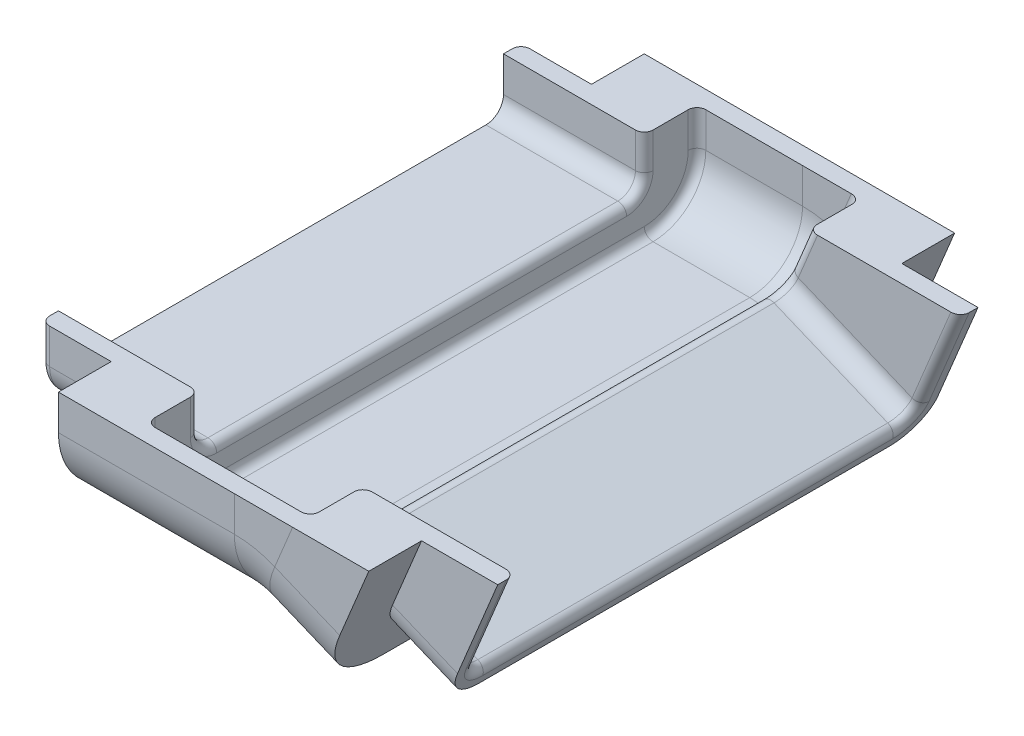
from build123d import *

# Parameters (mm, degrees)
BOSS_EXTRUDE6_DEPTH = 4
BOSS_EXTRUDE7_DEPTH = 4
FILLET5_R           = 0.5
BOSS_EXTRUDE8_DEPTH = 4
BOSS_EXTRUDE9_START = -4
BOSS_EXTRUDE9_DEPTH = 4
FILLET6_R           = 0.5


with BuildPart() as part:
    # Sweep1: sweep along a path in Sketch2path
    with BuildLine(Plane.XY) as sweep1_path:
        Line((17.522352454, -2.291938404), (13.826834324, -0.761204675))
        ThreePointArc((13.826834324, -0.761204675), (11.95090322, -0.192147196), (10, 0))
        Line((10, 0), (0, 0))
    # Sketch3 → Sweep1 (sweep)
    with BuildSketch(Plane(origin=(0, 0, 0), x_dir=(0, 0, -1), z_dir=(1, 0, 0))):
        with BuildLine():
            Line((-16.65, -4), (-16.65, 4))
            ThreePointArc((-16.65, 4), (-15.478427125, 6.828427125), (-12.65, 8))
            Line((-12.65, 8), (12.65, 8))
            ThreePointArc((12.65, 8), (15.478427125, 6.828427125), (16.65, 4))
            Line((16.65, 4), (16.65, -4))
            ThreePointArc((16.65, -4), (15.478427125, -6.828427125), (12.65, -8))
            Line((12.65, -8), (-12.65, -8))
            ThreePointArc((-12.65, -8), (-15.478427125, -6.828427125), (-16.65, -4))
        make_face()
        with BuildLine():
            Line((-15.65, -4), (-15.65, 4))
            ThreePointArc((-15.65, 4), (-14.771320344, 6.121320344), (-12.65, 7))
            Line((-12.65, 7), (12.65, 7))
            ThreePointArc((12.65, 7), (14.771320344, 6.121320344), (15.65, 4))
            Line((15.65, 4), (15.65, -4))
            ThreePointArc((15.65, -4), (14.771320344, -6.121320344), (12.65, -7))
            Line((12.65, -7), (-12.65, -7))
            ThreePointArc((-12.65, -7), (-14.771320344, -6.121320344), (-15.65, -4))
        make_face(mode=Mode.SUBTRACT)
    sweep(path=sweep1_path.line)



with BuildPart() as body_2:
    # Sketch18 → Boss-Extrude6 (new, symmetric)
    with BuildSketch(Plane.ZY):
        with BuildLine():
            Line((-11.65, 5), (0, 5))
            Line((0, 5), (0, 6))
            Line((0, 6), (-11.65, 6))
            ThreePointArc((-11.65, 6), (-13.064213562, 5.414213562), (-13.65, 4))
            Line((-13.65, 4), (-13.65, 0))
            Line((-13.65, 0), (-12.65, 0))
            Line((-12.65, 0), (-12.65, 4))
            ThreePointArc((-12.65, 4), (-12.357106781, 4.707106781), (-11.65, 5))
        make_face()
    extrude(amount=BOSS_EXTRUDE6_DEPTH, both=True)

    # Mirror6: body 2 across plane


with BuildPart() as body_2_1:
    add(body_2.part)
    add(body_2.part.mirror(Plane.XY))

    # Mirror7: body 2 across plane


with BuildPart() as body_2_2:
    add(body_2_1.part)
    add(body_2_1.part.mirror(Plane(origin=(-4, 0, 0), x_dir=(0, 0, 1), z_dir=(0, -1, 0))))


with BuildPart() as part_1:
    add(part.part)

    add(body_2_2.part)  # Boss-Extrude7 merges body 2
    # Sketch19 → Boss-Extrude7 (add)
    with BuildSketch(Plane.ZY):
        with BuildLine():
            Line((-15.65, -4), (-15.65, 4))
            ThreePointArc((-15.65, 4), (-14.771320344, 6.121320344), (-12.65, 7))
            Line((-12.65, 7), (12.65, 7))
            ThreePointArc((12.65, 7), (14.771320344, 6.121320344), (15.65, 4))
            Line((15.65, 4), (15.65, -4))
            ThreePointArc((15.65, -4), (14.771320344, -6.121320344), (12.65, -7))
            Line((12.65, -7), (-12.65, -7))
            ThreePointArc((-12.65, -7), (-14.771320344, -6.121320344), (-15.65, -4))
        make_face()
        with BuildLine():
            Line((-13.65, -4), (-13.65, 4))
            ThreePointArc((-13.65, 4), (-13.064213562, 5.414213562), (-11.65, 6))
            Line((-11.65, 6), (11.65, 6))
            ThreePointArc((11.65, 6), (13.064213562, 5.414213562), (13.65, 4))
            Line((13.65, 4), (13.65, -4))
            ThreePointArc((13.65, -4), (13.064213562, -5.414213562), (11.65, -6))
            Line((11.65, -6), (-11.65, -6))
            ThreePointArc((-11.65, -6), (-13.064213562, -5.414213562), (-13.65, -4))
        make_face(mode=Mode.SUBTRACT)
    extrude(amount=-BOSS_EXTRUDE7_DEPTH)

    # Fillet5
    fillet5_edges = [part_1.edges().sort_by_distance(p)[0] for p in [
        (4, -6.121320344, -14.771320344),
        (4, 0, -15.65),
        (4, 6.121320344, -14.771320344),
        (4, 7, 0),
        (4, 6.121320344, 14.771320344),
        (4, 0, 15.65),
        (4, -6.121320344, 14.771320344),
        (4, -7, 0),
        (-4, 0, -13.65),
        (-4, 6, 0),
        (-4, 5.414213562, 13.064213562),
        (-4, -5.414213562, -13.064213562),
        (4, 5, 0),
        (4, 0, -12.65),
        (-4, -6, 0),
        (-4, -5.414213562, 13.064213562),
        (-4, 0, 13.65),
        (-4, 5.414213562, -13.064213562),
        (4, 4.707106781, -12.357106781),
        (4, -5, 0),
        (4, -4.707106781, 12.357106781),
        (4, 0, 12.65),
        (4, 4.707106781, 12.357106781),
        (4, -4.707106781, -12.357106781),
    ]]
    fillet(fillet5_edges, radius=FILLET5_R)



with BuildPart() as body_2_2_1:
    # Sketch20 → Boss-Extrude8 (new, symmetric)
    with BuildSketch(Plane(origin=(15.766585942, -6.530733729, 0), x_dir=(0, 0, -1), z_dir=(0.9238795325112864, -0.38268343236509084, 0))):
        with BuildLine():
            ThreePointArc((-11.65, 9.588038999), (-12.357106781, 9.29514578), (-12.65, 8.588038999))
            Line((-12.65, 8.588038999), (-12.65, 4.588038999))
            Line((-12.65, 4.588038999), (-13.65, 4.588038999))
            Line((-13.65, 4.588038999), (-13.65, 8.588038999))
            ThreePointArc((-13.65, 8.588038999), (-13.064213562, 10.002252561), (-11.65, 10.588038999))
            Line((-11.65, 10.588038999), (0, 10.588038999))
            Line((0, 10.588038999), (0, 9.588038999))
            Line((0, 9.588038999), (-11.65, 9.588038999))
        make_face()
    extrude(amount=BOSS_EXTRUDE8_DEPTH, both=True)

    # Mirror8: body 2 2 across plane


with BuildPart() as body_2_2_2:
    add(body_2_2_1.part)
    add(body_2_2_1.part.mirror(Plane(origin=(1.755766512, 4.238795325, 0), x_dir=(0, 0, 1), z_dir=(0.3826834323650908, 0.9238795325112864, 0))))

    # Mirror9: body 2 2 across plane


with BuildPart() as body_2_2_3:
    add(body_2_2_2.part)
    add(body_2_2_2.part.mirror(Plane.XY))


with BuildPart() as part_2:
    add(part_1.part)

    add(body_2_2_3.part)  # Boss-Extrude9 merges body 2 2
    # Sketch21 → Boss-Extrude9 (add)
    with BuildSketch(Plane(origin=(15.766585942, -6.530733729, 0), x_dir=(0, 0, -1), z_dir=(0.9238795325112864, -0.38268343236509084, 0)).offset(BOSS_EXTRUDE9_START)):
        with BuildLine():
            Line((-15.65, 8.588038999), (-15.65, 0.588038999))
            ThreePointArc((-15.65, 0.588038999), (-14.771320344, -1.533281345), (-12.65, -2.411961001))
            Line((-12.65, -2.411961001), (12.65, -2.411961001))
            ThreePointArc((12.65, -2.411961001), (14.771320344, -1.533281345), (15.65, 0.588038999))
            Line((15.65, 0.588038999), (15.65, 8.588038999))
            ThreePointArc((15.65, 8.588038999), (14.771320344, 10.709359342), (12.65, 11.588038999))
            Line((12.65, 11.588038999), (-12.65, 11.588038999))
            ThreePointArc((-12.65, 11.588038999), (-14.771320344, 10.709359342), (-15.65, 8.588038999))
        make_face()
        with BuildLine():
            Line((-13.65, 8.588038999), (-13.65, 0.588038999))
            ThreePointArc((-13.65, 0.588038999), (-13.064213562, -0.826174564), (-11.65, -1.411961001))
            Line((-11.65, -1.411961001), (11.65, -1.411961001))
            ThreePointArc((11.65, -1.411961001), (13.064213562, -0.826174564), (13.65, 0.588038999))
            Line((13.65, 0.588038999), (13.65, 8.588038999))
            ThreePointArc((13.65, 8.588038999), (13.064213562, 10.002252561), (11.65, 10.588038999))
            Line((11.65, 10.588038999), (-11.65, 10.588038999))
            ThreePointArc((-11.65, 10.588038999), (-13.064213562, 10.002252561), (-13.65, 8.588038999))
        make_face(mode=Mode.SUBTRACT)
    extrude(amount=BOSS_EXTRUDE9_DEPTH)

    # Fillet6
    fillet6_edges = [part_2.edges().sort_by_distance(p)[0] for p in [
        (23.019202363, 0.526127479, 12.357106781),
        (23.131287746, 0.796725529, 0),
        (21.217870584, -3.822672134, 12.65),
        (23.019202363, 0.526127479, -12.357106781),
        (21.217870584, -3.822672134, -12.65),
        (19.304453422, -8.442069796, 0),
        (19.416538804, -8.171471746, 12.357106781),
        (15.628166103, 3.587594938, 12.357106781),
        (13.826834324, -0.761204675, 12.65),
        (12.025502544, -5.110004287, -12.357106781),
        (15.740251485, 3.858192988, 0),
        (12.025502544, -5.110004287, 12.357106781),
        (11.913417162, -5.380602337, 0),
        (15.628166103, 3.587594938, -12.357106781),
        (13.826834324, -0.761204675, -12.65),
        (19.416538804, -8.171471746, -12.357106781),
        (16.169362203, 4.894157902, 14.771320344),
        (13.826834324, -0.761204675, 15.65),
        (11.484306444, -6.416567252, 14.771320344),
        (11.148050297, -7.228361402, 0),
        (11.484306444, -6.416567252, -14.771320344),
        (13.826834324, -0.761204675, -15.65),
        (16.169362203, 4.894157902, -14.771320344),
        (16.50561835, 5.705952053, 0),
    ]]
    fillet(fillet6_edges, radius=FILLET6_R)

    # SurfaceCut1
    split(bisect_by=Plane(origin=(0, -2, 0), x_dir=(1, 0, 0), z_dir=(0, 1, 0)), keep=Keep.BOTTOM)


solid = part_2.part
